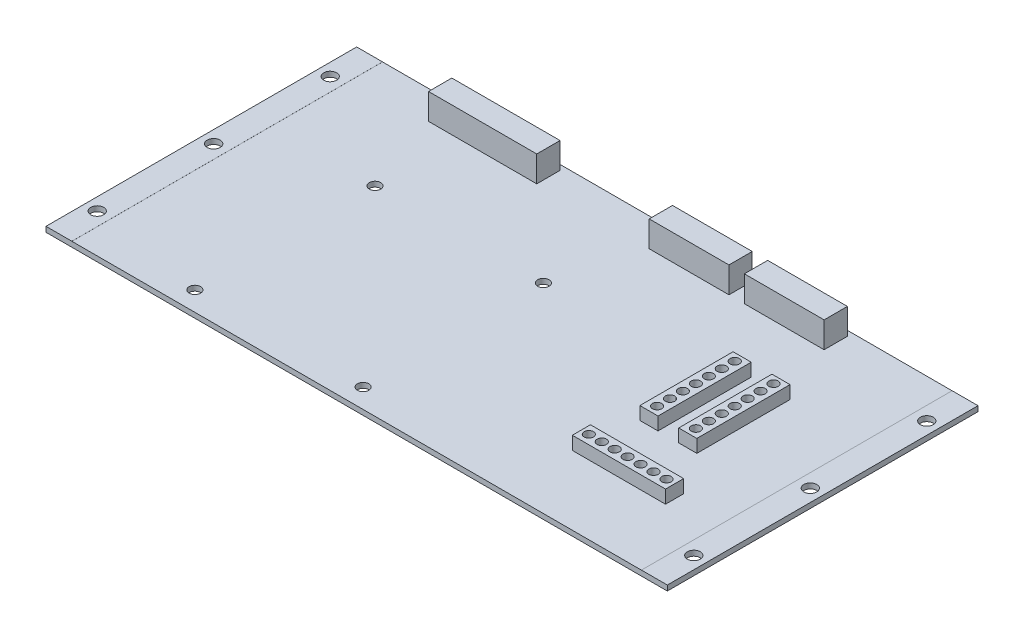
from build123d import *

# Parameters (mm, degrees)
SKETCH1_W              = 304.8
SKETCH1_H              = 152.4
SKETCH1_R              = 3.175
SKETCH1_R_2            = 2.794
BOARD_DEPTH            = 2.54
SKETCH3_W              = 53.086
SKETCH3_H              = 11.43
D25TOCOMPUTER_DEPTH    = 12.7
SKETCH5_W              = 39.116
SKETCH5_H              = 11.43
D15TOMOTOR_BRAKE_DEPTH = 12.7
SKETCH9_W              = 8.89
SKETCH9_H              = 45.72
SKETCH9_R              = 2.286
MOTORS_BRAKES_DEPTH    = 6.35
SKETCH10_W             = 12.7
SKETCH10_H             = 152.4
SKETCH10_R             = 3.175
PLATEDEDGE_DEPTH       = 0.0254
SKETCH11_W             = 45.72
SKETCH11_H             = 8.89
SKETCH11_R             = 2.286
HVIN_24VIN_5VIN_DEPTH  = 6.4516


with BuildPart() as part:
    # Sketch1 → Board (new body)
    with BuildSketch(Plane(origin=(0, 0, 0), x_dir=(1, 0, 0), z_dir=(0, 1, 0))):
        with Locations((152.4, 76.2)):
            Rectangle(SKETCH1_W, SKETCH1_H)
        with Locations(Location((298.731278283, 76.2, 0), (0, 0, 270))):
            Circle(SKETCH1_R, mode=Mode.SUBTRACT)
        with Locations(Location((298.731278283, 133.35, 0), (0, 0, 270))):
            Circle(SKETCH1_R, mode=Mode.SUBTRACT)
        with Locations(Location((298.731278283, 19.05, 0), (0, 0, 90))):
            Circle(SKETCH1_R, mode=Mode.SUBTRACT)
        with Locations(Location((6.068721717, 19.05, 0), (0, 0, 270))):
            Circle(SKETCH1_R, mode=Mode.SUBTRACT)
        with Locations(Location((6.068721717, 76.2, 0), (0, 0, 90))):
            Circle(SKETCH1_R, mode=Mode.SUBTRACT)
        with Locations(Location((6.068721717, 133.35, 0), (0, 0, 90))):
            Circle(SKETCH1_R, mode=Mode.SUBTRACT)
        with Locations(Location((63.5, 9.525, 0), (0, 0, 270))):
            Circle(SKETCH1_R_2, mode=Mode.SUBTRACT)
        with Locations(Location((63.5, 97.917, 0), (0, 0, 270))):
            Circle(SKETCH1_R_2, mode=Mode.SUBTRACT)
        with Locations(Location((146.05, 97.917, 0), (0, 0, 270))):
            Circle(SKETCH1_R_2, mode=Mode.SUBTRACT)
        with Locations(Location((146.05, 9.525, 0), (0, 0, 270))):
            Circle(SKETCH1_R_2, mode=Mode.SUBTRACT)
    extrude(amount=BOARD_DEPTH)

    # Sketch3 → D25toComputer (add)
    with BuildSketch(Plane(origin=(0, 2.54, 0), x_dir=(-1, 0, 0), z_dir=(0, 1, 0))):
        with Locations((-75.767610713, -144.145)):
            Rectangle(SKETCH3_W, SKETCH3_H)
    extrude(amount=D25TOCOMPUTER_DEPTH)

    # Sketch5 → D15toMotor/Brake (add)
    with BuildSketch(Plane(origin=(0, 2.54, 0), x_dir=(-1, 0, 0), z_dir=(0, 1, 0))):
        with Locations((-177.038519959, -144.145)):
            Rectangle(SKETCH5_W, SKETCH5_H)
        with Locations((-223.715302991, -144.145)):
            Rectangle(SKETCH5_W, SKETCH5_H)
    extrude(amount=D15TOMOTOR_BRAKE_DEPTH)

    # Sketch9 → Motors/Brakes (add)
    # profile 1 of 2: a face of its own
    with BuildSketch(Plane(origin=(0, 2.54, 0), x_dir=(-1, 0, 0), z_dir=(0, 1, 0))):
        with Locations((-251.635702832, -86.062744457)):
            Rectangle(SKETCH9_W, SKETCH9_H)
        with Locations(Location((-251.635702832, -73.524162022, 0), (0, 0, 90))):
            Circle(SKETCH9_R, mode=Mode.SUBTRACT)
        with Locations(Location((-251.635702832, -67.174162022, 0), (0, 0, 90))):
            Circle(SKETCH9_R, mode=Mode.SUBTRACT)
        with Locations(Location((-251.635702832, -86.224162022, 0), (0, 0, 90))):
            Circle(SKETCH9_R, mode=Mode.SUBTRACT)
        with Locations(Location((-251.635702832, -79.874162022, 0), (0, 0, 90))):
            Circle(SKETCH9_R, mode=Mode.SUBTRACT)
        with Locations(Location((-251.635702832, -98.924162022, 0), (0, 0, 90))):
            Circle(SKETCH9_R, mode=Mode.SUBTRACT)
        with Locations(Location((-251.635702832, -92.574162022, 0), (0, 0, 90))):
            Circle(SKETCH9_R, mode=Mode.SUBTRACT)
        with Locations(Location((-251.635702832, -105.274162022, 0), (0, 0, 90))):
            Circle(SKETCH9_R, mode=Mode.SUBTRACT)
    # profile 2 of 2: a face of its own
    with BuildSketch(Plane(origin=(0, 2.54, 0), x_dir=(-1, 0, 0), z_dir=(0, 1, 0))):
        with Locations((-232.585702832, -86.062744457)):
            Rectangle(SKETCH9_W, SKETCH9_H)
        with Locations(Location((-232.585702832, -79.874162022, 0), (0, 0, 90))):
            Circle(SKETCH9_R, mode=Mode.SUBTRACT)
        with Locations(Location((-232.585702832, -67.174162022, 0), (0, 0, 90))):
            Circle(SKETCH9_R, mode=Mode.SUBTRACT)
        with Locations(Location((-232.585702832, -98.924162022, 0), (0, 0, 90))):
            Circle(SKETCH9_R, mode=Mode.SUBTRACT)
        with Locations(Location((-232.585702832, -105.274162022, 0), (0, 0, 90))):
            Circle(SKETCH9_R, mode=Mode.SUBTRACT)
        with Locations(Location((-232.585702832, -73.524162022, 0), (0, 0, 90))):
            Circle(SKETCH9_R, mode=Mode.SUBTRACT)
        with Locations(Location((-232.585702832, -86.224162022, 0), (0, 0, 90))):
            Circle(SKETCH9_R, mode=Mode.SUBTRACT)
        with Locations(Location((-232.585702832, -92.574162022, 0), (0, 0, 90))):
            Circle(SKETCH9_R, mode=Mode.SUBTRACT)
    extrude(amount=MOTORS_BRAKES_DEPTH)

    # Sketch10 → platedEdge (add)
    # profile 1 of 2: a face of its own
    with BuildSketch(Plane(origin=(0, 2.54, 0), x_dir=(-1, 0, 0), z_dir=(0, 1, 0))):
        with Locations((-298.45, -76.2)):
            Rectangle(SKETCH10_W, SKETCH10_H)
        with Locations(Location((-298.731278283, -133.35, 0), (0, 0, 90))):
            Circle(SKETCH10_R, mode=Mode.SUBTRACT)
        with Locations(Location((-298.731278283, -76.2, 0), (0, 0, 90))):
            Circle(SKETCH10_R, mode=Mode.SUBTRACT)
        with Locations(Location((-298.731278283, -19.05, 0), (0, 0, 270))):
            Circle(SKETCH10_R, mode=Mode.SUBTRACT)
    # profile 2 of 2: a face of its own
    with BuildSketch(Plane(origin=(0, 2.54, 0), x_dir=(-1, 0, 0), z_dir=(0, 1, 0))):
        with Locations((-6.35, -76.2)):
            Rectangle(SKETCH10_W, SKETCH10_H)
        with Locations(Location((-6.068721717, -19.05, 0), (0, 0, 90))):
            Circle(SKETCH10_R, mode=Mode.SUBTRACT)
        with Locations(Location((-6.068721717, -76.2, 0), (0, 0, 270))):
            Circle(SKETCH10_R, mode=Mode.SUBTRACT)
        with Locations(Location((-6.068721717, -133.35, 0), (0, 0, 270))):
            Circle(SKETCH10_R, mode=Mode.SUBTRACT)
    extrude(amount=PLATEDEDGE_DEPTH)

    # Sketch11 → HVin/24Vin/5Vin (add)
    with BuildSketch(Plane(origin=(0, 2.54, 0), x_dir=(-1, 0, 0), z_dir=(0, 1, 0))):
        with Locations((-247.144556465, -38.354996588)):
            Rectangle(SKETCH11_W, SKETCH11_H)
        with Locations(Location((-259.683138901, -38.354996588, 0), (0, 0, 90))):
            Circle(SKETCH11_R, mode=Mode.SUBTRACT)
        with Locations(Location((-227.933138901, -38.354996588, 0), (0, 0, 90))):
            Circle(SKETCH11_R, mode=Mode.SUBTRACT)
        with Locations(Location((-253.333138901, -38.354996588, 0), (0, 0, 90))):
            Circle(SKETCH11_R, mode=Mode.SUBTRACT)
        with Locations(Location((-234.283138901, -38.354996588, 0), (0, 0, 90))):
            Circle(SKETCH11_R, mode=Mode.SUBTRACT)
        with Locations(Location((-246.983138901, -38.354996588, 0), (0, 0, 90))):
            Circle(SKETCH11_R, mode=Mode.SUBTRACT)
        with Locations(Location((-266.033138901, -38.354996588, 0), (0, 0, 90))):
            Circle(SKETCH11_R, mode=Mode.SUBTRACT)
        with Locations(Location((-240.633138901, -38.354996588, 0), (0, 0, 90))):
            Circle(SKETCH11_R, mode=Mode.SUBTRACT)
    extrude(amount=HVIN_24VIN_5VIN_DEPTH)


solid = part.part
